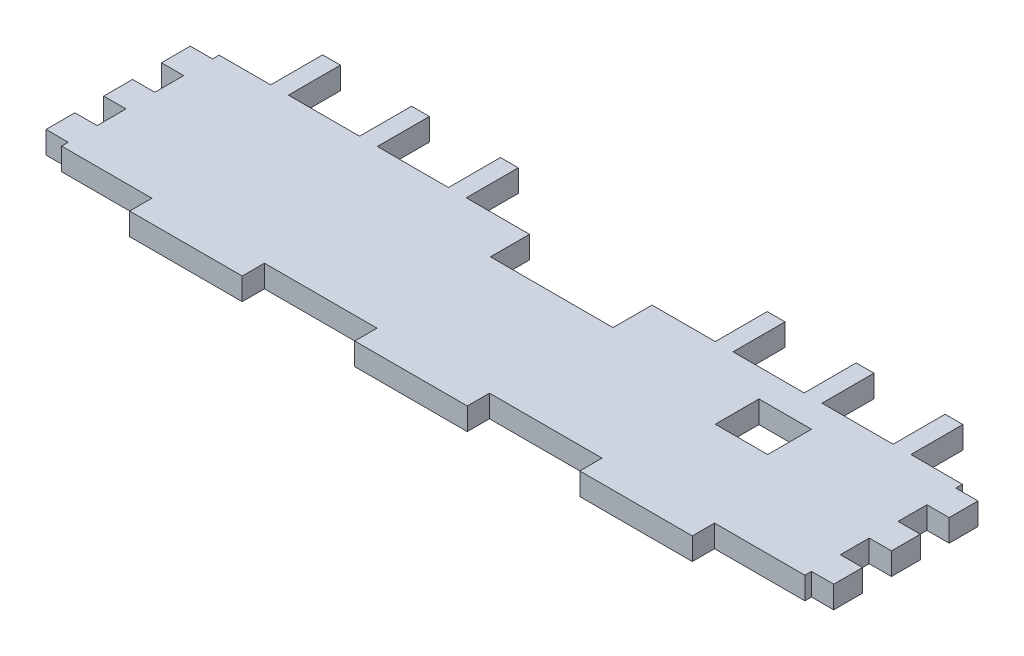
from build123d import *

# Parameters (mm, degrees)
SKETCH1_W           = 32.142857142
SKETCH1_H           = 6.35
SKETCH1_W_2         = 32.142857143
SKETCH1_W_3         = 6.35
SKETCH1_H_2         = 8.242857143
SKETCH1_H_3         = 8.242857142
BOSS_EXTRUDE1_DEPTH = 6.35
SKETCH2_W           = 212.3
SKETCH2_H           = 6.35
SKETCH2_W_2         = 5.08
SKETCH2_H_2         = 8.5
BOSS_EXTRUDE2_DEPTH = 6.35
SKETCH3_W           = 35
SKETCH3_H           = 26
CUT_EXTRUDE1_DEPTH  = 235.622595885
SKETCH4_W           = 14.71
SKETCH4_H           = 6.35
SKETCH4_W_2         = 20.32
CUT_EXTRUDE2_DEPTH  = 6.35
SKETCH5_W           = 20.32
SKETCH5_H           = 6.35
SKETCH5_W_2         = 18.06
CUT_EXTRUDE3_DEPTH  = 235.622595885
SKETCH8_W           = 15
SKETCH8_H           = 12.5
CUT_EXTRUDE6_DEPTH  = 235.622595885


with BuildPart() as part:
    # Sketch1 → Boss-Extrude1 (new body)
    with BuildSketch(Plane(origin=(0, 0, 0), x_dir=(1, 0, 0), z_dir=(0, 1, 0))):
        Polygon((6.35, 6.35), (32.142857143, 6.35), (64.285714286, 6.35), (96.428571429, 6.35), (128.571428571, 6.35), (160.714285714, 6.35), (192.857142857, 6.35), (218.65, 6.35), (218.65, 8.242857143), (218.65, 16.485714286), (218.65, 24.728571429), (218.65, 32.971428571), (218.65, 41.214285714), (218.65, 49.457142857), (218.65, 51.35), (192.857142857, 51.35), (160.714285714, 51.35), (128.571428571, 51.35), (96.428571429, 51.35), (64.285714286, 51.35), (32.142857143, 51.35), (6.35, 51.35), (6.35, 49.457142857), (6.35, 41.214285714), (6.35, 32.971428571), (6.35, 24.728571429), (6.35, 16.485714286), (6.35, 8.242857143), align=None)
        with Locations((112.5, 54.525)):
            Rectangle(SKETCH1_W, SKETCH1_H)
        with Locations((112.5, 3.175)):
            Rectangle(SKETCH1_W, SKETCH1_H)
        with Locations((176.785714286, 3.175)):
            Rectangle(SKETCH1_W_2, SKETCH1_H)
        with Locations((176.785714286, 54.525)):
            Rectangle(SKETCH1_W_2, SKETCH1_H)
        with Locations((48.214285715, 54.525)):
            Rectangle(SKETCH1_W_2, SKETCH1_H)
        with Locations((48.214285715, 3.175)):
            Rectangle(SKETCH1_W_2, SKETCH1_H)
        with Locations((3.175, 12.364285714)):
            Rectangle(SKETCH1_W_3, SKETCH1_H_2)
        with Locations((3.175, 28.85)):
            Rectangle(SKETCH1_W_3, SKETCH1_H_3)
        with Locations((3.175, 45.335714286)):
            Rectangle(SKETCH1_W_3, SKETCH1_H_2)
        with Locations((221.825, 12.364285714)):
            Rectangle(SKETCH1_W_3, SKETCH1_H_2)
        with Locations((221.825, 28.85)):
            Rectangle(SKETCH1_W_3, SKETCH1_H_3)
        with Locations((221.825, 45.335714286)):
            Rectangle(SKETCH1_W_3, SKETCH1_H_2)
    extrude(amount=BOSS_EXTRUDE1_DEPTH)

    # Sketch2 → Boss-Extrude2 (add)
    with BuildSketch(Plane(origin=(0, 6.35, 0), x_dir=(1, 0, 0), z_dir=(0, 1, 0))):
        with Locations((112.5, 54.525)):
            Rectangle(SKETCH2_W, SKETCH2_H)
        with Locations((23.6, 61.95)):
            Rectangle(SKETCH2_W_2, SKETCH2_H_2)
        with Locations((49, 61.95)):
            Rectangle(SKETCH2_W_2, SKETCH2_H_2)
        with Locations((74.4, 61.95)):
            Rectangle(SKETCH2_W_2, SKETCH2_H_2)
        with Locations((99.8, 61.95)):
            Rectangle(SKETCH2_W_2, SKETCH2_H_2)
        with Locations((201.4, 61.95)):
            Rectangle(SKETCH2_W_2, SKETCH2_H_2)
        with Locations((176, 61.95)):
            Rectangle(SKETCH2_W_2, SKETCH2_H_2)
        with Locations((125.2, 61.95)):
            Rectangle(SKETCH2_W_2, SKETCH2_H_2)
        with Locations((150.6, 61.95)):
            Rectangle(SKETCH2_W_2, SKETCH2_H_2)
    extrude(amount=-BOSS_EXTRUDE2_DEPTH)

    # Sketch3 → Cut-Extrude1 (cut, through all)
    with BuildSketch(Plane(origin=(0, 6.35, 0), x_dir=(1, 0, 0), z_dir=(0, 1, 0))):
        with Locations((112.5, 53.2)):
            Rectangle(SKETCH3_W, SKETCH3_H)
    extrude(amount=-CUT_EXTRUDE1_DEPTH, mode=Mode.SUBTRACT)

    # Sketch4 → Cut-Extrude2 (cut)
    with BuildSketch(Plane(origin=(0, 6.35, 0), x_dir=(1, 0, 0), z_dir=(0, 1, 0))):
        with Locations((13.705, 54.525)):
            Rectangle(SKETCH4_W, SKETCH4_H)
        with Locations((36.3, 54.525)):
            Rectangle(SKETCH4_W_2, SKETCH4_H)
        with Locations((211.295, 54.525)):
            Rectangle(SKETCH4_W, SKETCH4_H)
        with Locations((188.7, 54.525)):
            Rectangle(SKETCH4_W_2, SKETCH4_H)
    extrude(amount=-CUT_EXTRUDE2_DEPTH, mode=Mode.SUBTRACT)

    # Sketch5 → Cut-Extrude3 (cut, through all)
    with BuildSketch(Plane(origin=(0, 6.35, 0), x_dir=(1, 0, 0), z_dir=(0, 1, 0))):
        with Locations((61.7, 54.525)):
            Rectangle(SKETCH5_W, SKETCH5_H)
        with Locations((85.97, 54.525)):
            Rectangle(SKETCH5_W_2, SKETCH5_H)
        with Locations((139.03, 54.525)):
            Rectangle(SKETCH5_W_2, SKETCH5_H)
        with Locations((163.3, 54.525)):
            Rectangle(SKETCH5_W, SKETCH5_H)
    extrude(amount=-CUT_EXTRUDE3_DEPTH, mode=Mode.SUBTRACT)

    # Sketch8 → Cut-Extrude6 (cut, through all)
    with BuildSketch(Plane(origin=(0, 6.35, 0), x_dir=(1, 0, 0), z_dir=(0, 1, 0))):
        with Locations((176, 37.15)):
            Rectangle(SKETCH8_W, SKETCH8_H)
    extrude(amount=-CUT_EXTRUDE6_DEPTH, mode=Mode.SUBTRACT)


solid = part.part
